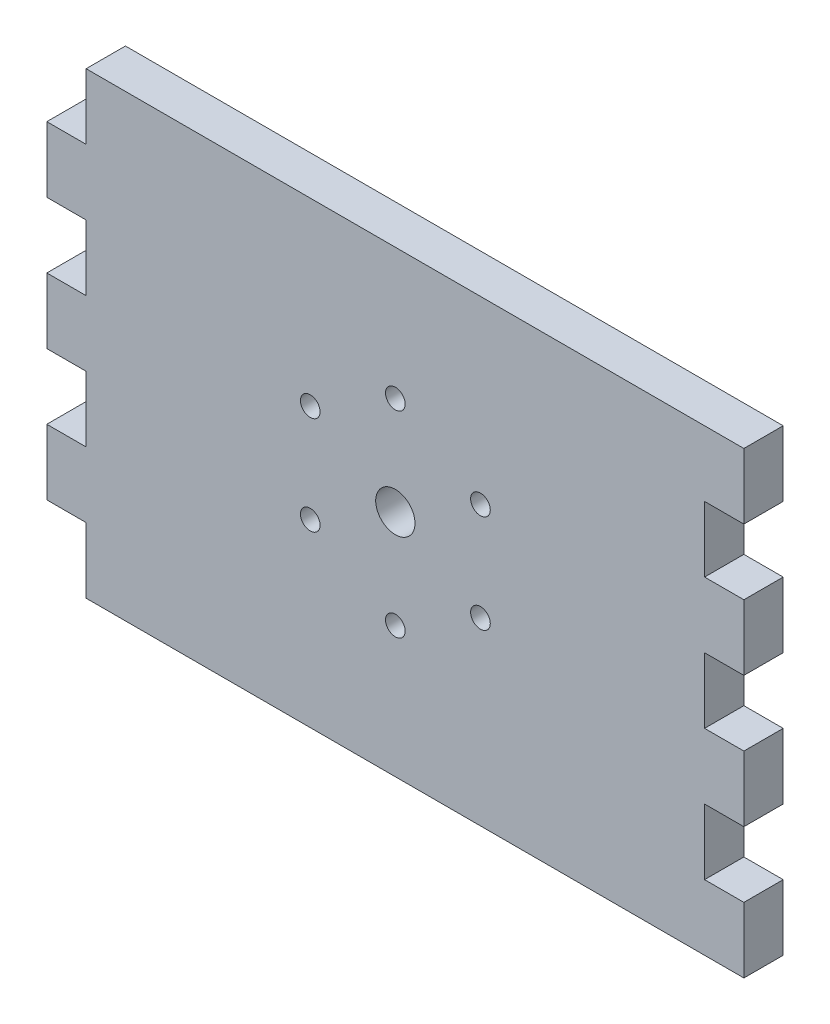
from build123d import *

# Parameters (mm, degrees)
SALIENTE_EXTRUIR1_DEPTH = 3
CORTAR_EXTRUIR1_REACH   = 33.981
CROQUIS2_R              = 0.75
CROQUIS2_R_2            = 1.5


with BuildPart() as part:
    # Croquis1 → Saliente-Extruir1 (new body)
    with BuildSketch(Plane.XY):
        Polygon((26.6, 2.5), (26.6, 7.5), (23.6, 7.5), (23.6, 12.5), (26.6, 12.5), (26.6, 17.5), (26.581338058, 17.5), (-23.6, 17.5), (-23.6, 12.5), (-26.6, 12.5), (-26.6, 7.5), (-23.6, 7.5), (-23.6, 2.5), (-26.6, 2.5), (-26.6, -2.5), (-23.6, -2.5), (-23.6, -7.5), (-26.6, -7.5), (-26.6, -12.5), (-23.6, -12.5), (-23.6, -17.5), (26.6, -17.5), (26.6, -12.5), (23.6, -12.5), (23.6, -7.5), (26.6, -7.5), (26.6, -2.5), (23.6, -2.5), (23.6, 2.5), align=None)
    extrude(amount=SALIENTE_EXTRUIR1_DEPTH)

    # Croquis2 → Cortar-Extruir1 (cut, up to next)
    with BuildSketch(Plane.XY.offset(3), mode=Mode.PRIVATE) as cortar_extruir1_sk1:
        with Locations((0, 7.5)):
            Circle(CROQUIS2_R)
    cortar_extruir1_tool1 = extrude(cortar_extruir1_sk1.sketch, amount=-CORTAR_EXTRUIR1_REACH, mode=Mode.PRIVATE) & part.part
    # Croquis2 → Cortar-Extruir1 (cut, up to next)
    with BuildSketch(Plane.XY.offset(3), mode=Mode.PRIVATE) as cortar_extruir1_sk2:
        with Locations((6.495190528, 3.75)):
            Circle(CROQUIS2_R)
    cortar_extruir1_tool2 = extrude(cortar_extruir1_sk2.sketch, amount=-CORTAR_EXTRUIR1_REACH, mode=Mode.PRIVATE) & part.part
    # Croquis2 → Cortar-Extruir1 (cut, up to next)
    with BuildSketch(Plane.XY.offset(3), mode=Mode.PRIVATE) as cortar_extruir1_sk3:
        with Locations((6.495190528, -3.75)):
            Circle(CROQUIS2_R)
    cortar_extruir1_tool3 = extrude(cortar_extruir1_sk3.sketch, amount=-CORTAR_EXTRUIR1_REACH, mode=Mode.PRIVATE) & part.part
    # Croquis2 → Cortar-Extruir1 (cut, up to next)
    with BuildSketch(Plane.XY.offset(3), mode=Mode.PRIVATE) as cortar_extruir1_sk4:
        with Locations((0, -7.5)):
            Circle(CROQUIS2_R)
    cortar_extruir1_tool4 = extrude(cortar_extruir1_sk4.sketch, amount=-CORTAR_EXTRUIR1_REACH, mode=Mode.PRIVATE) & part.part
    # Croquis2 → Cortar-Extruir1 (cut, up to next)
    with BuildSketch(Plane.XY.offset(3), mode=Mode.PRIVATE) as cortar_extruir1_sk5:
        with Locations((-6.495190528, -3.75)):
            Circle(CROQUIS2_R)
    cortar_extruir1_tool5 = extrude(cortar_extruir1_sk5.sketch, amount=-CORTAR_EXTRUIR1_REACH, mode=Mode.PRIVATE) & part.part
    # Croquis2 → Cortar-Extruir1 (cut, up to next)
    with BuildSketch(Plane.XY.offset(3), mode=Mode.PRIVATE) as cortar_extruir1_sk6:
        with Locations((-6.495190528, 3.75)):
            Circle(CROQUIS2_R)
    cortar_extruir1_tool6 = extrude(cortar_extruir1_sk6.sketch, amount=-CORTAR_EXTRUIR1_REACH, mode=Mode.PRIVATE) & part.part
    # Croquis2 → Cortar-Extruir1 (cut, up to next)
    with BuildSketch(Plane.XY.offset(3), mode=Mode.PRIVATE) as cortar_extruir1_sk7:
        Circle(CROQUIS2_R_2)
    cortar_extruir1_tool7 = extrude(cortar_extruir1_sk7.sketch, amount=-CORTAR_EXTRUIR1_REACH, mode=Mode.PRIVATE) & part.part
    add(cortar_extruir1_tool1.solids().sort_by_distance((0, 7.5, 3))[0], mode=Mode.SUBTRACT)
    add(cortar_extruir1_tool2.solids().sort_by_distance((6.495191, 3.75, 3))[0], mode=Mode.SUBTRACT)
    add(cortar_extruir1_tool3.solids().sort_by_distance((6.495191, -3.75, 3))[0], mode=Mode.SUBTRACT)
    add(cortar_extruir1_tool4.solids().sort_by_distance((0, -7.5, 3))[0], mode=Mode.SUBTRACT)
    add(cortar_extruir1_tool5.solids().sort_by_distance((-6.495191, -3.75, 3))[0], mode=Mode.SUBTRACT)
    add(cortar_extruir1_tool6.solids().sort_by_distance((-6.495191, 3.75, 3))[0], mode=Mode.SUBTRACT)
    add(cortar_extruir1_tool7.solids().sort_by_distance((0, 0, 3))[0], mode=Mode.SUBTRACT)


solid = part.part
